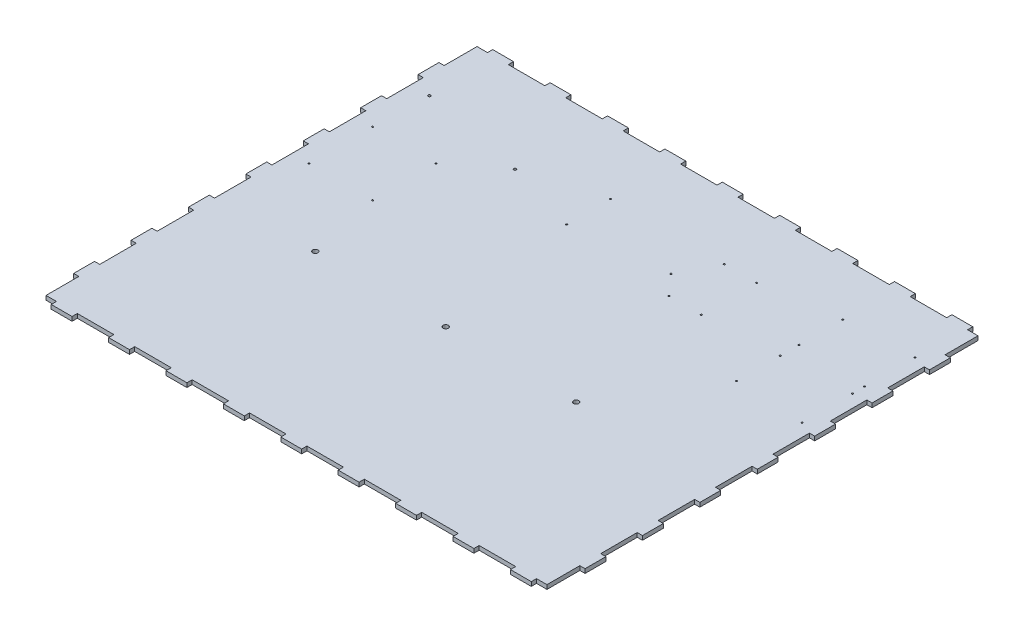
from build123d import *

# Parameters (mm, degrees)
SKETCH1_W                        = 480
SKETCH1_H                        = 413
BASE_DEPTH                       = 4
SKETCH2_W                        = 20
SKETCH2_H                        = 5
TOP_TABS_DEFINITION_DEPTH        = 4
TOP_TABS_PATTERN_COUNT           = 5
TOP_TABS_PATTERN_PITCH           = 55
TOP_TABS_PATTERN_COL_COUNT       = 5
TOP_TABS_PATTERN_COL_PITCH       = 55
BOTTOM_TABS_COPY_1_SKETCH_W      = 20
BOTTOM_TABS_COPY_1_SKETCH_H      = 5
BOTTOM_TABS_COPY_1_DEPTH         = 4
BOTTOM_TABS_COPY_2_SKETCH_W      = 20
BOTTOM_TABS_COPY_2_SKETCH_H      = 5
BOTTOM_TABS_COPY_2_DEPTH         = 4
BOTTOM_TABS_COPY_3_SKETCH_W      = 20
BOTTOM_TABS_COPY_3_SKETCH_H      = 5
BOTTOM_TABS_COPY_3_DEPTH         = 4
BOTTOM_TABS_COPY_4_SKETCH_W      = 20
BOTTOM_TABS_COPY_4_SKETCH_H      = 5
BOTTOM_TABS_COPY_4_DEPTH         = 4
BOTTOM_TABS_COPY_5_SKETCH_W      = 20
BOTTOM_TABS_COPY_5_SKETCH_H      = 5
BOTTOM_TABS_COPY_5_DEPTH         = 4
BOTTOM_TABS_COPY_6_SKETCH_W      = 20
BOTTOM_TABS_COPY_6_SKETCH_H      = 5
BOTTOM_TABS_COPY_6_DEPTH         = 4
BOTTOM_TABS_COPY_7_SKETCH_W      = 20
BOTTOM_TABS_COPY_7_SKETCH_H      = 5
BOTTOM_TABS_COPY_7_DEPTH         = 4
BOTTOM_TABS_COPY_8_SKETCH_W      = 20
BOTTOM_TABS_COPY_8_SKETCH_H      = 5
BOTTOM_TABS_COPY_8_DEPTH         = 4
ELECTRONICS_MOUNTING_HOLES_1_5_D = 1.5
SKETCH7_W                        = 5
SKETCH7_H                        = 20
LEFT_TABS_DEFINITION_DEPTH       = 4
LEFT_TABS_PATTERN_COUNT          = 4
LEFT_TABS_PATTERN_PITCH          = 55
LEFT_TABS_PATTERN_COL_COUNT      = 4
LEFT_TABS_PATTERN_COL_PITCH      = 55
RIGHT_TABS_COPY_1_SKETCH_W       = 5
RIGHT_TABS_COPY_1_SKETCH_H       = 20
RIGHT_TABS_COPY_1_DEPTH          = 4
RIGHT_TABS_COPY_2_SKETCH_W       = 5
RIGHT_TABS_COPY_2_SKETCH_H       = 20
RIGHT_TABS_COPY_2_DEPTH          = 4
RIGHT_TABS_COPY_3_SKETCH_W       = 5
RIGHT_TABS_COPY_3_SKETCH_H       = 20
RIGHT_TABS_COPY_3_DEPTH          = 4
RIGHT_TABS_COPY_4_SKETCH_W       = 5
RIGHT_TABS_COPY_4_SKETCH_H       = 20
RIGHT_TABS_COPY_4_DEPTH          = 4
RIGHT_TABS_COPY_5_SKETCH_W       = 5
RIGHT_TABS_COPY_5_SKETCH_H       = 20
RIGHT_TABS_COPY_5_DEPTH          = 4
RIGHT_TABS_COPY_6_SKETCH_W       = 5
RIGHT_TABS_COPY_6_SKETCH_H       = 20
RIGHT_TABS_COPY_6_DEPTH          = 4
M6_CLEARANCE_HOLE1_D             = 5
TAP_DRILL_FOR_M3X0_5_TAP1_D      = 2.5


with BuildPart() as part:
    # Sketch1 → Base (new body)
    with BuildSketch(Plane(origin=(0, 0, 0), x_dir=(1, 0, 0), z_dir=(0, 1, 0))):
        Rectangle(SKETCH1_W, SKETCH1_H)
    extrude(amount=BASE_DEPTH)

    # Sketch2 → Top Tabs Definition (add)
    with BuildSketch(Plane(origin=(0, 4, 0), x_dir=(1, 0, 0), z_dir=(0, 1, 0))):
        with Locations((0, 209)):
            Rectangle(SKETCH2_W, SKETCH2_H)
    top_tabs_definition = extrude(amount=-TOP_TABS_DEFINITION_DEPTH)

    # Top Tabs Pattern: Top Tabs Definition ×5
    with Locations(*[(-i * TOP_TABS_PATTERN_PITCH, 0, 0) for i in range(1, TOP_TABS_PATTERN_COUNT)]):
        add(top_tabs_definition)

    # Top Tabs Pattern col: Top Tabs Definition ×5
    with Locations(*[(i * TOP_TABS_PATTERN_COL_PITCH, 0, 0) for i in range(1, TOP_TABS_PATTERN_COL_COUNT)]):
        add(top_tabs_definition)

    # Bottom Tabs: Top Tabs Definition across plane
    add(top_tabs_definition.mirror(Plane.XY))

    # Bottom Tabs copy 1 sketch → Bottom Tabs copy 1 (add)
    with BuildSketch(Plane(origin=(-55, 4, 0), x_dir=(1, 0, 0), z_dir=(0, 1, 0))):
        with Locations((0, -209)):
            Rectangle(BOTTOM_TABS_COPY_1_SKETCH_W, BOTTOM_TABS_COPY_1_SKETCH_H)
    extrude(amount=-BOTTOM_TABS_COPY_1_DEPTH)

    # Bottom Tabs copy 2 sketch → Bottom Tabs copy 2 (add)
    with BuildSketch(Plane(origin=(-110, 4, 0), x_dir=(1, 0, 0), z_dir=(0, 1, 0))):
        with Locations((0, -209)):
            Rectangle(BOTTOM_TABS_COPY_2_SKETCH_W, BOTTOM_TABS_COPY_2_SKETCH_H)
    extrude(amount=-BOTTOM_TABS_COPY_2_DEPTH)

    # Bottom Tabs copy 3 sketch → Bottom Tabs copy 3 (add)
    with BuildSketch(Plane(origin=(-165, 4, 0), x_dir=(1, 0, 0), z_dir=(0, 1, 0))):
        with Locations((0, -209)):
            Rectangle(BOTTOM_TABS_COPY_3_SKETCH_W, BOTTOM_TABS_COPY_3_SKETCH_H)
    extrude(amount=-BOTTOM_TABS_COPY_3_DEPTH)

    # Bottom Tabs copy 4 sketch → Bottom Tabs copy 4 (add)
    with BuildSketch(Plane(origin=(-220, 4, 0), x_dir=(1, 0, 0), z_dir=(0, 1, 0))):
        with Locations((0, -209)):
            Rectangle(BOTTOM_TABS_COPY_4_SKETCH_W, BOTTOM_TABS_COPY_4_SKETCH_H)
    extrude(amount=-BOTTOM_TABS_COPY_4_DEPTH)

    # Bottom Tabs copy 5 sketch → Bottom Tabs copy 5 (add)
    with BuildSketch(Plane(origin=(55, 4, 0), x_dir=(1, 0, 0), z_dir=(0, 1, 0))):
        with Locations((0, -209)):
            Rectangle(BOTTOM_TABS_COPY_5_SKETCH_W, BOTTOM_TABS_COPY_5_SKETCH_H)
    extrude(amount=-BOTTOM_TABS_COPY_5_DEPTH)

    # Bottom Tabs copy 6 sketch → Bottom Tabs copy 6 (add)
    with BuildSketch(Plane(origin=(110, 4, 0), x_dir=(1, 0, 0), z_dir=(0, 1, 0))):
        with Locations((0, -209)):
            Rectangle(BOTTOM_TABS_COPY_6_SKETCH_W, BOTTOM_TABS_COPY_6_SKETCH_H)
    extrude(amount=-BOTTOM_TABS_COPY_6_DEPTH)

    # Bottom Tabs copy 7 sketch → Bottom Tabs copy 7 (add)
    with BuildSketch(Plane(origin=(165, 4, 0), x_dir=(1, 0, 0), z_dir=(0, 1, 0))):
        with Locations((0, -209)):
            Rectangle(BOTTOM_TABS_COPY_7_SKETCH_W, BOTTOM_TABS_COPY_7_SKETCH_H)
    extrude(amount=-BOTTOM_TABS_COPY_7_DEPTH)

    # Bottom Tabs copy 8 sketch → Bottom Tabs copy 8 (add)
    with BuildSketch(Plane(origin=(220, 4, 0), x_dir=(1, 0, 0), z_dir=(0, 1, 0))):
        with Locations((0, -209)):
            Rectangle(BOTTOM_TABS_COPY_8_SKETCH_W, BOTTOM_TABS_COPY_8_SKETCH_H)
    extrude(amount=-BOTTOM_TABS_COPY_8_DEPTH)

    # Electronics Mounting Holes (1.5) (through all)
    with Locations(Plane(origin=(0, 4, 0), x_dir=(1, 0, 0), z_dir=(0, 1, 0))):
        with Locations((-49.45, 143.854151385), (-49.45, 101.854151385), (41.55, 110.854151385), (59.05, 144.354151385), (90.05, 144.354151385), (90.05, 91.354151385), (59.05, 91.354151385), (161.815, 95.130848615), (161.815, 53.220848615), (161.815, 155.130848615), (161.815, 113.220848615), (227.855, 110.045848615), (227.855, 158.305848615), (227.855, 50.045848615), (227.855, 98.305848615), (-162.5, 28.854151385), (-162.5, 89.854151385), (-223.5, 89.854151385), (-223.5, 28.854151385)):
            Hole(ELECTRONICS_MOUNTING_HOLES_1_5_D / 2)

    # Sketch7 → Left Tabs Definition (add)
    with BuildSketch(Plane(origin=(0, 4, 0), x_dir=(1, 0, 0), z_dir=(0, 1, 0))):
        with Locations((-242.5, 0)):
            Rectangle(SKETCH7_W, SKETCH7_H)
    left_tabs_definition = extrude(amount=-LEFT_TABS_DEFINITION_DEPTH)

    # Left Tabs Pattern: Left Tabs Definition ×4
    with Locations(*[(0, 0, -i * LEFT_TABS_PATTERN_PITCH) for i in range(1, LEFT_TABS_PATTERN_COUNT)]):
        add(left_tabs_definition)

    # Left Tabs Pattern col: Left Tabs Definition ×4
    with Locations(*[(0, 0, i * LEFT_TABS_PATTERN_COL_PITCH) for i in range(1, LEFT_TABS_PATTERN_COL_COUNT)]):
        add(left_tabs_definition)

    # Right Tabs: Left Tabs Definition across plane
    add(left_tabs_definition.mirror(Plane(origin=(0, 0, 0), x_dir=(0, 0, 1), z_dir=(1, 0, 0))))

    # Right Tabs copy 1 sketch → Right Tabs copy 1 (add)
    with BuildSketch(Plane(origin=(0, 4, -55), x_dir=(-1, 0, 0), z_dir=(0, 1, 0))):
        with Locations((-242.5, 0)):
            Rectangle(RIGHT_TABS_COPY_1_SKETCH_W, RIGHT_TABS_COPY_1_SKETCH_H)
    extrude(amount=-RIGHT_TABS_COPY_1_DEPTH)

    # Right Tabs copy 2 sketch → Right Tabs copy 2 (add)
    with BuildSketch(Plane(origin=(0, 4, -110), x_dir=(-1, 0, 0), z_dir=(0, 1, 0))):
        with Locations((-242.5, 0)):
            Rectangle(RIGHT_TABS_COPY_2_SKETCH_W, RIGHT_TABS_COPY_2_SKETCH_H)
    extrude(amount=-RIGHT_TABS_COPY_2_DEPTH)

    # Right Tabs copy 3 sketch → Right Tabs copy 3 (add)
    with BuildSketch(Plane(origin=(0, 4, -165), x_dir=(-1, 0, 0), z_dir=(0, 1, 0))):
        with Locations((-242.5, 0)):
            Rectangle(RIGHT_TABS_COPY_3_SKETCH_W, RIGHT_TABS_COPY_3_SKETCH_H)
    extrude(amount=-RIGHT_TABS_COPY_3_DEPTH)

    # Right Tabs copy 4 sketch → Right Tabs copy 4 (add)
    with BuildSketch(Plane(origin=(0, 4, 55), x_dir=(-1, 0, 0), z_dir=(0, 1, 0))):
        with Locations((-242.5, 0)):
            Rectangle(RIGHT_TABS_COPY_4_SKETCH_W, RIGHT_TABS_COPY_4_SKETCH_H)
    extrude(amount=-RIGHT_TABS_COPY_4_DEPTH)

    # Right Tabs copy 5 sketch → Right Tabs copy 5 (add)
    with BuildSketch(Plane(origin=(0, 4, 110), x_dir=(-1, 0, 0), z_dir=(0, 1, 0))):
        with Locations((-242.5, 0)):
            Rectangle(RIGHT_TABS_COPY_5_SKETCH_W, RIGHT_TABS_COPY_5_SKETCH_H)
    extrude(amount=-RIGHT_TABS_COPY_5_DEPTH)

    # Right Tabs copy 6 sketch → Right Tabs copy 6 (add)
    with BuildSketch(Plane(origin=(0, 4, 165), x_dir=(-1, 0, 0), z_dir=(0, 1, 0))):
        with Locations((-242.5, 0)):
            Rectangle(RIGHT_TABS_COPY_6_SKETCH_W, RIGHT_TABS_COPY_6_SKETCH_H)
    extrude(amount=-RIGHT_TABS_COPY_6_DEPTH)

    # M6 Clearance Hole1 (through all)
    with Locations(Plane(origin=(0, 4, 0), x_dir=(1, 0, 0), z_dir=(0, 1, 0))):
        with Locations((-147.5, -40.969284902), (-22.5, -40.969284902), (102.5, -40.969284902)):
            Hole(M6_CLEARANCE_HOLE1_D / 2)

    # Tap Drill for M3x0.5 Tap1 (through all)
    with Locations(Plane(origin=(0, 0, 0), x_dir=(-1, 0, 0), z_dir=(0, -1, 0))):
        with Locations((120, 122.854151385), (222, 142.854151385)):
            Hole(TAP_DRILL_FOR_M3X0_5_TAP1_D / 2)


solid = part.part
